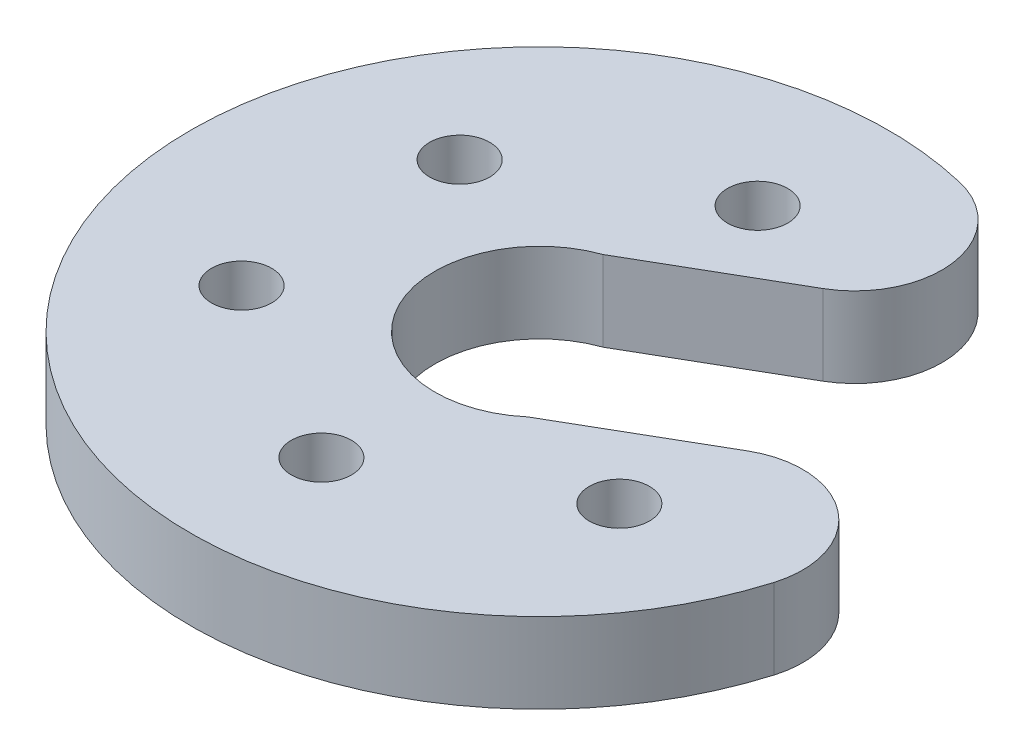
from build123d import *

# Parameters (mm, degrees)
SKETCH1_R               = 20
SKETCH1_R_2             = 6
SKETCH1_R_3             = 1.725
BOSS_EXTRUDE1_DEPTH     = 4.6
CUT_EXTRUDE1_DEPTH      = 29.655889447
CUT_EXTRUDE1_DEPTH_BACK = 29.655889447
SKETCH2_R               = 1.725
FILLET2_R               = 5


with BuildPart() as part:
    # Sketch1 → Boss-Extrude1 (new body)
    with BuildSketch(Plane(origin=(0, 0, 0), x_dir=(1, 0, 0), z_dir=(0, 1, 0))):
        with Locations(Location((0, 0, 0), (0, 0, 270))):
            Circle(SKETCH1_R)
        with Locations(Location((0, 0, 0), (0, 0, 270))):
            Circle(SKETCH1_R_2, mode=Mode.SUBTRACT)
        with Locations(Location((0, 12.5, 0), (0, 0, 270))):
            Circle(SKETCH1_R_3, mode=Mode.SUBTRACT)
        with Locations(Location((10.825317547, 6.25, 0), (0, 0, 270))):
            Circle(SKETCH1_R_3, mode=Mode.SUBTRACT)
        with Locations(Location((10.825317547, -6.25, 0), (0, 0, 270))):
            Circle(SKETCH1_R_3, mode=Mode.SUBTRACT)
        with Locations(Location((0, -12.5, 0), (0, 0, 270))):
            Circle(SKETCH1_R_3, mode=Mode.SUBTRACT)
        with Locations(Location((-10.825317547, -6.25, 0), (0, 0, 270))):
            Circle(SKETCH1_R_3, mode=Mode.SUBTRACT)
        with Locations(Location((-10.825317547, 6.25, 0), (0, 0, 270))):
            Circle(SKETCH1_R_3, mode=Mode.SUBTRACT)
    extrude(amount=BOSS_EXTRUDE1_DEPTH)

    # Sketch2 → Cut-Extrude1 (cut, two sides: drawn at the far end of the back side and taken through both)
    with BuildSketch(Plane(origin=(0, 4.6, 0), x_dir=(1, 0, 0), z_dir=(0, 1, 0)).offset(-CUT_EXTRUDE1_DEPTH_BACK)):
        with BuildLine():
            Line((13.599697882, 14.66452241), (-2.005277819, 5.654985488))
            ThreePointArc((-2.005277819, 5.654985488), (3.461815498, 4.900595214), (6, 0))
            ThreePointArc((6, 0), (5.448317772, -2.5131322), (3.894722181, -4.564114277))
            Line((3.894722181, -4.564114277), (19.499697882, 4.445422645))
            ThreePointArc((19.499697882, 4.445422645), (17.320508076, 10), (13.599697882, 14.66452241))
        make_face()
        with Locations((10.825317547, 6.25)):
            Circle(SKETCH2_R, mode=Mode.SUBTRACT)
    extrude(amount=CUT_EXTRUDE1_DEPTH + CUT_EXTRUDE1_DEPTH_BACK, mode=Mode.SUBTRACT)

    # Fillet2
    fillet2_edges = [part.edges().sort_by_distance(p)[0] for p in [
        (19.499697882, 2.3, -4.445422645),
        (13.599697882, 2.3, -14.66452241),
    ]]
    fillet(fillet2_edges, radius=FILLET2_R)


solid = part.part
